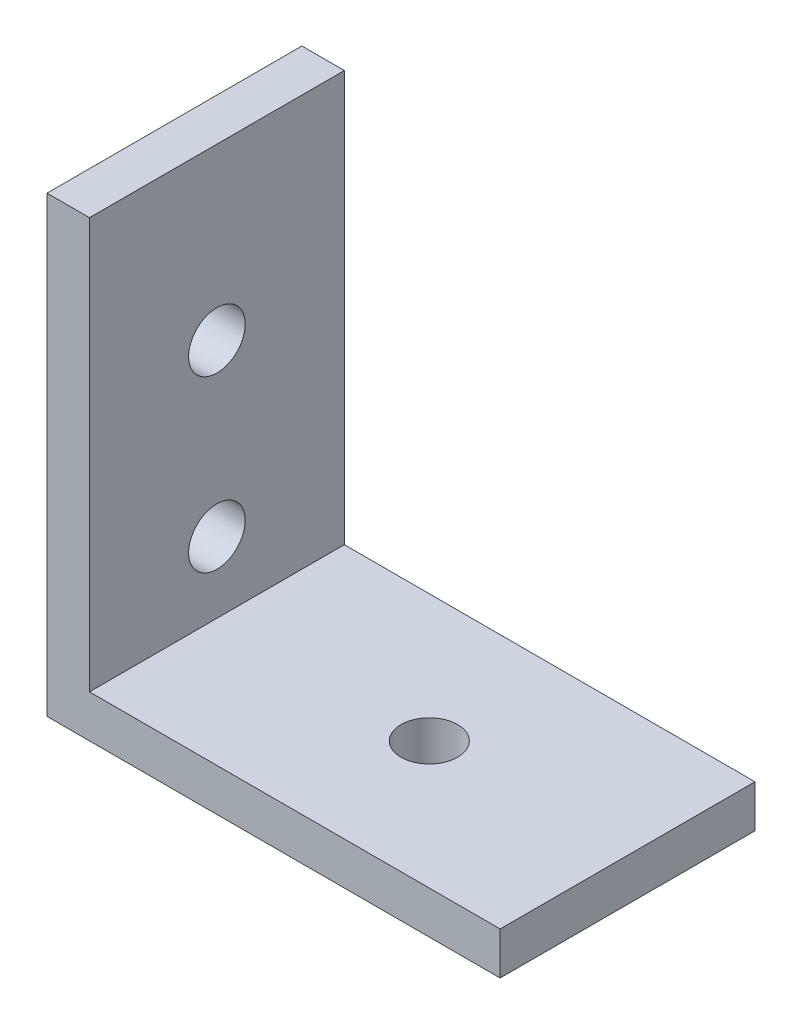
from build123d import *

# Parameters (mm, degrees)
SKETCH1_W           = 32
SKETCH1_H           = 18
BOSS_EXTRUDE1_DEPTH = 3
SKETCH2_W           = 3
SKETCH2_H           = 18
BOSS_EXTRUDE2_DEPTH = 29
SKETCH3_R           = 2
CUT_EXTRUDE1_DEPTH  = 47.786750261
SKETCH4_R           = 2
CUT_EXTRUDE2_DEPTH  = 47.786750261


with BuildPart() as part:
    # Sketch1 → Boss-Extrude1 (new body)
    with BuildSketch(Plane(origin=(0, 0, 0), x_dir=(1, 0, 0), z_dir=(0, 1, 0))):
        with Locations((16, 9)):
            Rectangle(SKETCH1_W, SKETCH1_H)
    extrude(amount=BOSS_EXTRUDE1_DEPTH)

    # Sketch2 → Boss-Extrude2 (add)
    with BuildSketch(Plane(origin=(0, 3, 0), x_dir=(1, 0, 0), z_dir=(0, 1, 0))):
        with Locations((1.5, 9)):
            Rectangle(SKETCH2_W, SKETCH2_H)
    extrude(amount=BOSS_EXTRUDE2_DEPTH)

    # Sketch3 → Cut-Extrude1 (cut, through all)
    with BuildSketch(Plane(origin=(0, 3, 0), x_dir=(1, 0, 0), z_dir=(0, 1, 0))):
        with Locations(Location((18, 9, 0), (0, 0, 270))):
            Circle(SKETCH3_R)
    extrude(amount=-CUT_EXTRUDE1_DEPTH, mode=Mode.SUBTRACT)

    # Sketch4 → Cut-Extrude2 (cut, through all)
    with BuildSketch(Plane(origin=(3, 0, 0), x_dir=(0, 0, -1), z_dir=(1, 0, 0))):
        with Locations((9, 20)):
            Circle(SKETCH4_R)
        with Locations((9, 8)):
            Circle(SKETCH4_R)
    extrude(amount=-CUT_EXTRUDE2_DEPTH, mode=Mode.SUBTRACT)


solid = part.part
